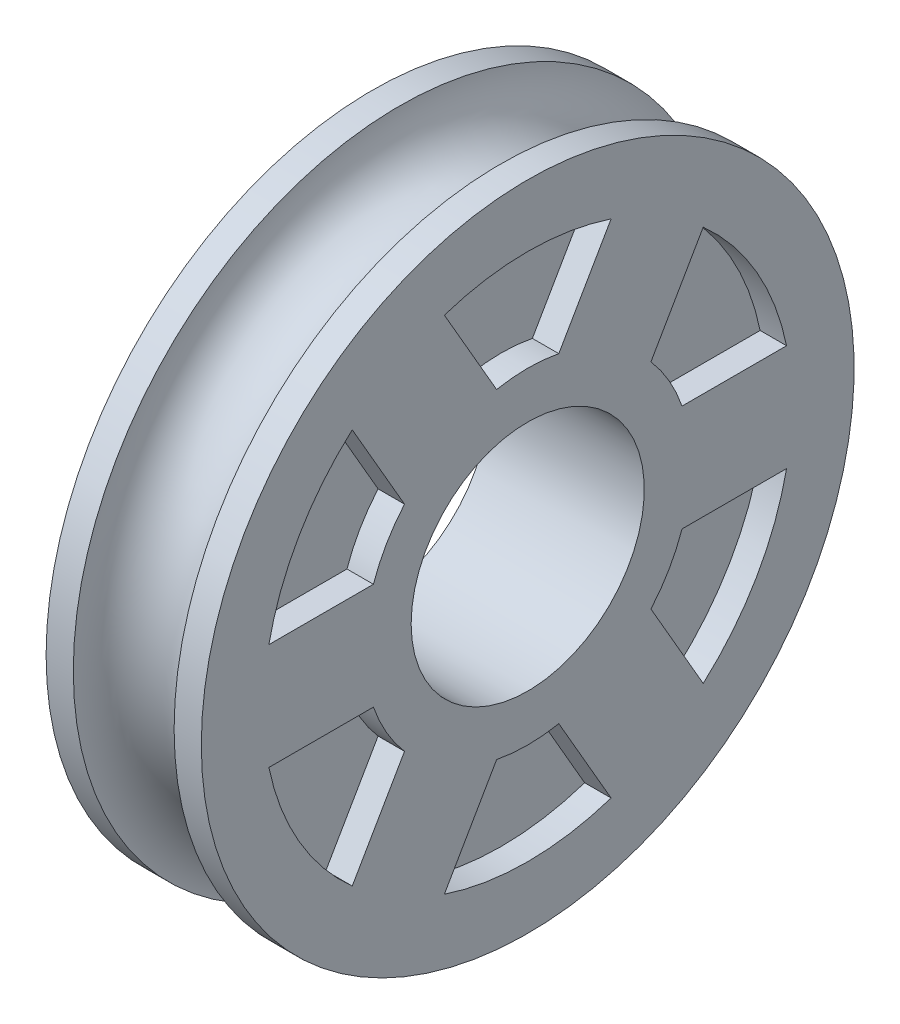
from build123d import *

# Parameters (mm, degrees)
CUT_EXTRUDE1_DEPTH      = 236
CUT_EXTRUDE1_DEPTH_BACK = 258
SKETCH2_R               = 75
CUT_EXTRUDE2_DEPTH      = 17


with BuildPart() as part:
    # Sketch1 → Revolve1 (revolve)
    with BuildSketch(Plane.XY, mode=Mode.PRIVATE) as revolve1_sk:
        with BuildLine():
            Line((0, 0), (100, 0))
            Line((100, 0), (100, 210))
            Line((100, 210), (82.499679128, 210))
            ThreePointArc((82.499679128, 210), (50.072209241, 177.355662093), (17.5, 209.855581875))
            Line((17.5, 209.855581875), (0, 209.855581875))
            Line((0, 209.855581875), (0, 0))
        make_face()
    revolve(revolve1_sk.sketch.rotate(Axis((0, 0, 0), (1, 0, 0)), 90), axis=Axis((0, 0, 0), (1, 0, 0)))

    # Sketch2 → Cut-Extrude1 (cut, two sides: drawn at the far end of the back side and taken through both)
    with BuildSketch(Plane(origin=(100, 0, 0), x_dir=(0, 0, -1), z_dir=(1, 0, 0)).offset(-CUT_EXTRUDE1_DEPTH_BACK)):
        with Locations(Location((0, 0, 0), (0, 0, 180))):
            Circle(SKETCH2_R)
    extrude(amount=CUT_EXTRUDE1_DEPTH + CUT_EXTRUDE1_DEPTH_BACK, mode=Mode.SUBTRACT)

    # Sketch3 → Cut-Extrude2 (cut)
    with BuildSketch(Plane.ZY):
        with BuildLine():
            Line((20, 103.07764064), (53.626367642, 161.32021787))
            ThreePointArc((53.626367642, 161.32021787), (0, 170), (-53.626367642, 161.32021787))
            Line((-53.626367642, 161.32021787), (-20, 103.07764064))
            ThreePointArc((-20, 103.07764064), (0, 105), (20, 103.07764064))
        make_face()
        with BuildLine():
            Line((112.894222998, 127.101905625), (79.267855357, 68.859328396))
            ThreePointArc((79.267855357, 68.859328396), (90.932667397, 52.5), (99.267855357, 34.218312245))
            Line((99.267855357, 34.218312245), (166.52059064, 34.218312245))
            ThreePointArc((166.52059064, 34.218312245), (147.224318643, 85), (112.894222998, 127.101905625))
        make_face()
        with BuildLine():
            Line((166.52059064, -34.218312245), (99.267855357, -34.218312245))
            ThreePointArc((99.267855357, -34.218312245), (90.932667397, -52.5), (79.267855357, -68.859328396))
            Line((79.267855357, -68.859328396), (112.894222998, -127.101905625))
            ThreePointArc((112.894222998, -127.101905625), (147.224318643, -85), (166.52059064, -34.218312245))
        make_face()
        with BuildLine():
            Line((53.626367642, -161.32021787), (20, -103.07764064))
            ThreePointArc((20, -103.07764064), (0, -105), (-20, -103.07764064))
            Line((-20, -103.07764064), (-53.626367642, -161.32021787))
            ThreePointArc((-53.626367642, -161.32021787), (0, -170), (53.626367642, -161.32021787))
        make_face()
        with BuildLine():
            Line((-112.894222998, -127.101905625), (-79.267855357, -68.859328396))
            ThreePointArc((-79.267855357, -68.859328396), (-90.932667397, -52.5), (-99.267855357, -34.218312245))
            Line((-99.267855357, -34.218312245), (-166.52059064, -34.218312245))
            ThreePointArc((-166.52059064, -34.218312245), (-147.224318643, -85), (-112.894222998, -127.101905625))
        make_face()
        with BuildLine():
            Line((-166.52059064, 34.218312245), (-99.267855357, 34.218312245))
            ThreePointArc((-99.267855357, 34.218312245), (-90.932667397, 52.5), (-79.267855357, 68.859328396))
            Line((-79.267855357, 68.859328396), (-112.894222998, 127.101905625))
            ThreePointArc((-112.894222998, 127.101905625), (-147.224318643, 85), (-166.52059064, 34.218312245))
        make_face()
    cut_extrude2 = extrude(amount=-CUT_EXTRUDE2_DEPTH, mode=Mode.SUBTRACT)

    # Mirror1: Cut-Extrude2 across plane
    add(cut_extrude2.mirror(Plane(origin=(50, 0, 0), x_dir=(0, 0, 1), z_dir=(1, 0, 0))), mode=Mode.SUBTRACT)


solid = part.part
